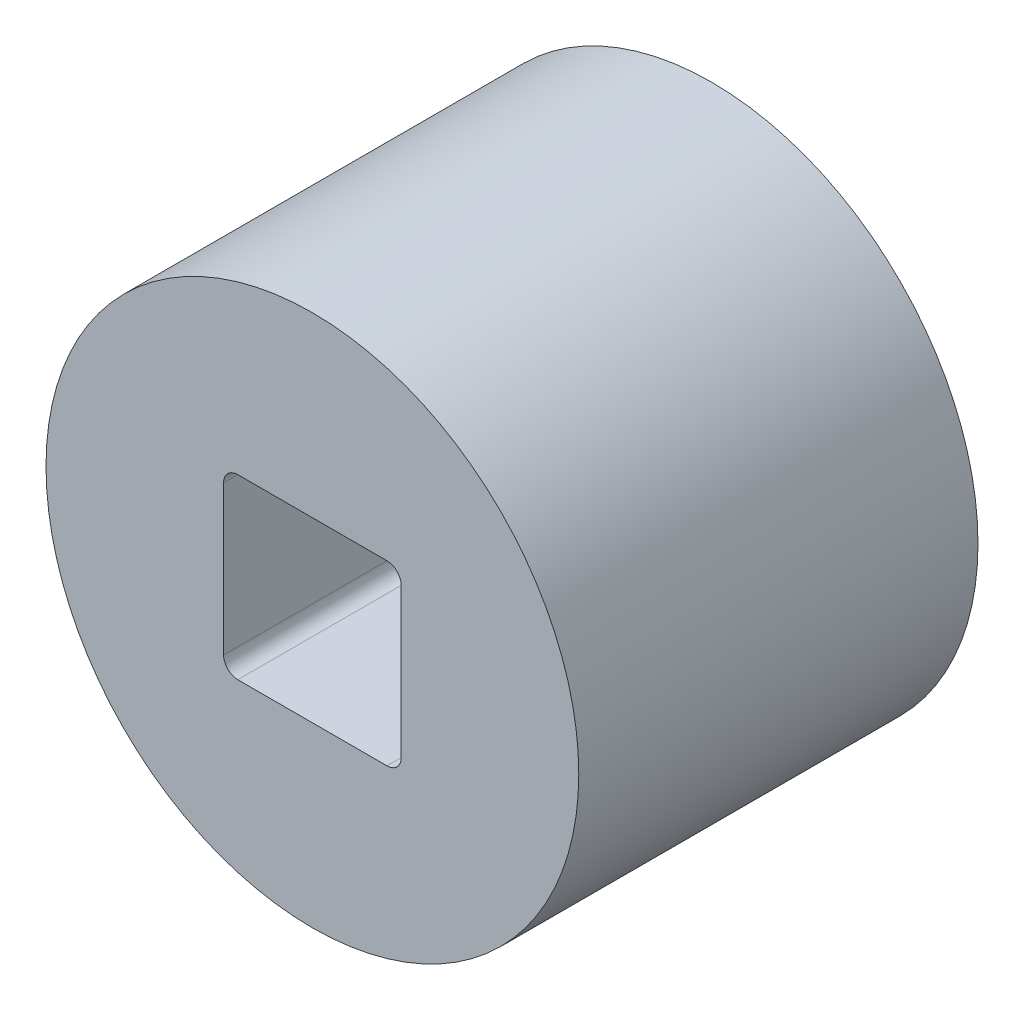
from build123d import *

# Parameters (mm, degrees)
SKETCH1_R           = 4.7625
BOSS_EXTRUDE1_DEPTH = 7.1374


with BuildPart() as part:
    # Sketch1 → Boss-Extrude1 (new body)
    with BuildSketch(Plane.XY):
        Circle(SKETCH1_R)
        with BuildLine():
            Line((1.3335, 1.5875), (-1.3335, 1.5875))
            ThreePointArc((-1.3335, 1.5875), (-1.513105122, 1.513105122), (-1.5875, 1.3335))
            Line((-1.5875, 1.3335), (-1.5875, -1.3335))
            ThreePointArc((-1.5875, -1.3335), (-1.513105122, -1.513105122), (-1.3335, -1.5875))
            Line((-1.3335, -1.5875), (1.3335, -1.5875))
            ThreePointArc((1.3335, -1.5875), (1.513105122, -1.513105122), (1.5875, -1.3335))
            Line((1.5875, -1.3335), (1.5875, 1.3335))
            ThreePointArc((1.5875, 1.3335), (1.513105122, 1.513105122), (1.3335, 1.5875))
        make_face(mode=Mode.SUBTRACT)
    extrude(amount=BOSS_EXTRUDE1_DEPTH)


solid = part.part
